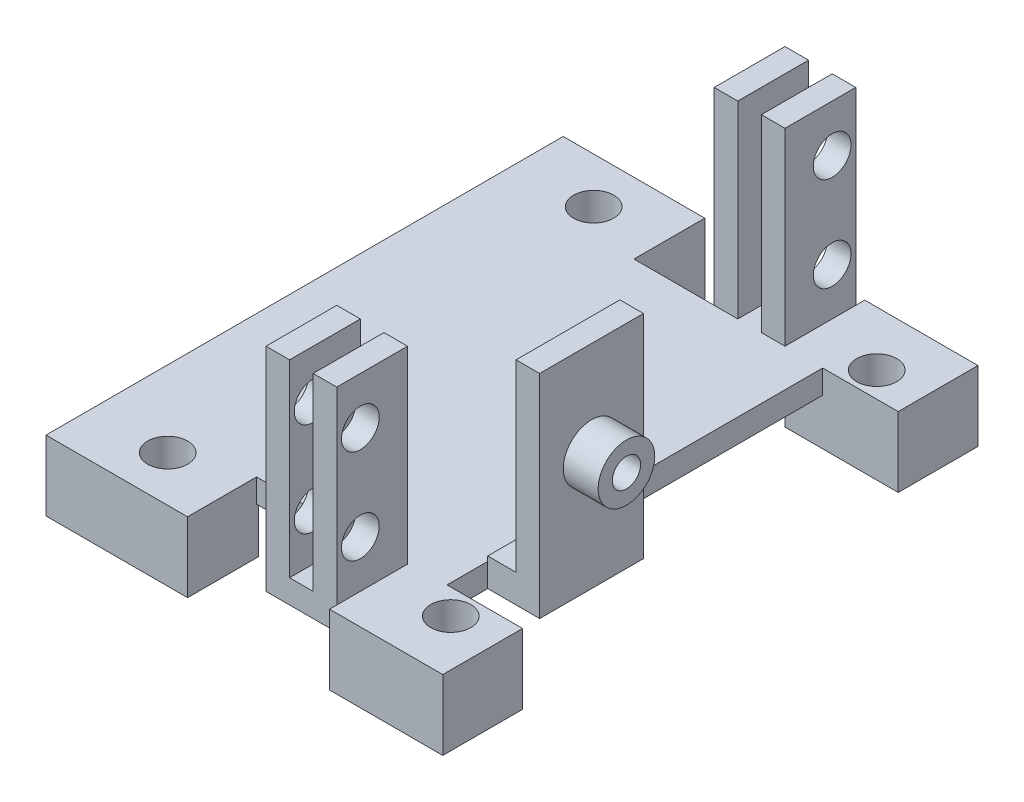
from build123d import *

# Parameters (mm, degrees)
SKETCH_1_W                = 211.717851242
SKETCH_1_H                = 121.662509304
EXTRUDE_1_DEPTH           = 10
SKETCH_2_W                = 5
SKETCH_2_H                = 15
EXTRUDE_2_DEPTH           = 40
CUT_EXTRUDE_1_DEPTH       = 129.477833404
CUT_EXTRUDE_1_DEPTH_BACK  = 129.477833404
SKETCH_3_OUTSIDE_W        = 263.568
SKETCH_3_OUTSIDE_H        = 173.512
SKETCH_4_W                = 15
SKETCH_4_H                = 15
EXTRUDE_3_DEPTH           = 10
CUT_EXTRUDE_2_DEPTH       = 130.428976448
CUT_EXTRUDE_2_DEPTH_BACK  = 5
SKETCH_5_W                = 251.048169007
SKETCH_5_H                = 208.83861988
CUT_EXTRUDE_3_DEPTH       = 97.900711095
CUT_EXTRUDE_3_DEPTH_BACK  = 97.900711095
SKETCH_7_R                = 4
SKETCH_8_W                = 6
SKETCH_8_H                = 22
EXTRUDE_6_DEPTH           = 6
CUT_EXTRUDE_4_DEPTH       = 128.58079771
CUT_EXTRUDE_4_DEPTH_BACK  = 128.58079771
SKETCH_10_W               = 17
SKETCH_10_H               = 6
EXTRUDE_7_DEPTH           = 5
SKETCH_11_R               = 11
EXTRUDE_8_DEPTH           = 0.6
SKETCH_12_R               = 6
EXTRUDE_9_DEPTH           = 7.4
CUT_EXTRUDE_10_DEPTH      = 116.586797735
CUT_EXTRUDE_10_DEPTH_BACK = 3
SKETCH_13_R               = 3
EXTRUDE_10_DEPTH          = 45
SKETCH_15_R               = 9.319080667
CUT_EXTRUDE_11_DEPTH      = 38
SKETCH_16_R               = 6
EXTRUDE_11_DEPTH          = 7.4
SKETCH_17_R               = 3
CUT_EXTRUDE_12_DEPTH      = 5
SKETCH_18_W               = 30
SKETCH_18_H               = 15
EXTRUDE_12_DEPTH          = 14.850514471
EXTRUDE_13_DEPTH          = 14.850514471
SKETCH_22_W               = 24
SKETCH_22_H               = 16.908951495
EXTRUDE_14_DEPTH          = 14.850514471
SKETCH_23_R               = 4.25
CUT_EXTRUDE_15_DEPTH      = 60
EXTRUDE_15_DEPTH          = 14.850514471
SKETCH_25_R               = 4.25
CUT_EXTRUDE_16_DEPTH      = 60
SKETCH_19_R               = 4.25
CUT_EXTRUDE_17_DEPTH      = 60
SKETCH_26_W               = 38.044769018
SKETCH_26_H               = 21.34609726
SKETCH_26_W_2             = 24.699869201
SKETCH_26_H_2             = 16.908951494
CUT_EXTRUDE_18_DEPTH      = 60
SKETCH_27_W               = 6.321147669
SKETCH_27_H               = 14.747228213
CUT_EXTRUDE_19_DEPTH      = 39


with BuildPart() as part:
    # 草图1 → 凸台-拉伸1 (new body)
    with BuildSketch(Plane(origin=(0, 0, 0), x_dir=(1, 0, 0), z_dir=(0, 1, 0))):
        Rectangle(SKETCH_1_W, SKETCH_1_H)
    extrude(amount=EXTRUDE_1_DEPTH)

    # 草图2 → 凸台-拉伸2 (add)
    with BuildSketch(Plane(origin=(0, 10, 0), x_dir=(1, 0, 0), z_dir=(0, 1, 0))):
        with Locations((-46.358925621, 47.311705854)):
            Rectangle(SKETCH_2_W, SKETCH_2_H)
        with Locations((-56.358925621, 47.311705854)):
            Rectangle(SKETCH_2_W, SKETCH_2_H)
        with Locations((-46.358925621, -47.688294146)):
            Rectangle(SKETCH_2_W, SKETCH_2_H)
        with Locations((-56.358925621, -47.688294146)):
            Rectangle(SKETCH_2_W, SKETCH_2_H)
    extrude(amount=EXTRUDE_2_DEPTH)

    # 草图3 outside → 切除-拉伸1 (cut, two sides: drawn at the far end of the back side and taken through both)
    with BuildSketch(Plane(origin=(0, 10, 0), x_dir=(1, 0, 0), z_dir=(0, 1, 0)).offset(-CUT_EXTRUDE_1_DEPTH_BACK)):
        Rectangle(SKETCH_3_OUTSIDE_W, SKETCH_3_OUTSIDE_H)
        Polygon((-105.858925621, 39.811705854), (-58.858925621, 39.811705854), (-58.858925621, 54.811705854), (-43.858925621, 54.811705854), (-43.858925621, 39.811705854), (-35.858925621, 39.811705854), (-35.858925621, -40.188294146), (-43.858925621, -40.188294146), (-43.858925621, -55.188294146), (-48.858925621, -55.188294146), (-48.858925621, -40.188294146), (-53.858925621, -40.188294146), (-53.858925621, -55.188294146), (-58.858925621, -55.188294146), (-58.858925621, -40.188294146), (-106.714815402, -40.188294146), align=None, mode=Mode.SUBTRACT)
    extrude(amount=CUT_EXTRUDE_1_DEPTH + CUT_EXTRUDE_1_DEPTH_BACK, mode=Mode.SUBTRACT)

    # 草图4 → 凸台-拉伸3 (add)
    with BuildSketch(Plane.XZ):
        with Locations((-51.358925621, 47.688294146)):
            Rectangle(SKETCH_4_W, SKETCH_4_H)
    extrude(amount=-EXTRUDE_3_DEPTH)

    # 草图5 → 切除-拉伸2 (cut, two sides: drawn at the far end of the back side and taken through both)
    with BuildSketch(Plane.XZ.offset(-CUT_EXTRUDE_2_DEPTH_BACK)):
        with Locations((-99.962010128, 39.987109066)):
            Rectangle(SKETCH_5_W, SKETCH_5_H)
    extrude(amount=CUT_EXTRUDE_2_DEPTH + CUT_EXTRUDE_2_DEPTH_BACK, mode=Mode.SUBTRACT)

    # 草图7 → 切除-拉伸3 (cut, two sides: drawn at the far end of the back side and taken through both)
    with BuildSketch(Plane(origin=(-43.858925621, 0, 0), x_dir=(0, 0, -1), z_dir=(1, 0, 0)).offset(-CUT_EXTRUDE_3_DEPTH_BACK)):
        with Locations((-50.188294146, 40)):
            Circle(SKETCH_7_R)
        with Locations((-50.188294146, 20)):
            Circle(SKETCH_7_R)
        with Locations((49.811705854, 40)):
            Circle(SKETCH_7_R)
        with Locations((49.811705854, 20)):
            Circle(SKETCH_7_R)
    extrude(amount=CUT_EXTRUDE_3_DEPTH + CUT_EXTRUDE_3_DEPTH_BACK, mode=Mode.SUBTRACT)

    # 草图8 → 凸台-拉伸6 (add)
    with BuildSketch(Plane.XZ.offset(-5)):
        with Locations((-32.858925621, 20.188294146)):
            Rectangle(SKETCH_8_W, SKETCH_8_H)
    extrude(amount=-EXTRUDE_6_DEPTH)

    # 草图9 → 切除-拉伸4 (cut, two sides: drawn at the far end of the back side and taken through both)
    with BuildSketch(Plane.XZ.offset(-5).offset(-CUT_EXTRUDE_4_DEPTH_BACK)):
        Polygon((-34.858925621, 39.188294146), (-34.858925621, 31.188294146), (-29.207793941, 25.537162465), (-29.207793941, 39.188294146), align=None)
    extrude(amount=CUT_EXTRUDE_4_DEPTH + CUT_EXTRUDE_4_DEPTH_BACK, mode=Mode.SUBTRACT)

    # 草图10 → 凸台-拉伸7 (add)
    with BuildSketch(Plane(origin=(-29.858925621, 0, 0), x_dir=(0, 0, -1), z_dir=(1, 0, 0))):
        Polygon((-31.188294146, 5), (-26.188294146, 5), (-26.188294146, 11), (-9.188294146, 11), (-9.188294146, 50), (-31.188294146, 50), align=None)
        with Locations((-17.688294146, 8)):
            Rectangle(SKETCH_10_W, SKETCH_10_H)
    extrude(amount=EXTRUDE_7_DEPTH)

    # 草图11 → 凸台-拉伸8 (add)
    with BuildSketch(Plane(origin=(-24.858925621, 0, 0), x_dir=(0, 0, -1), z_dir=(1, 0, 0))):
        with Locations((-20.188294146, 27.5)):
            Circle(SKETCH_11_R)
    extrude(amount=-EXTRUDE_8_DEPTH)

    # 草图12 → 凸台-拉伸9 (add)
    with BuildSketch(Plane(origin=(-24.858925621, 0, 0), x_dir=(0, 0, -1), z_dir=(1, 0, 0))):
        with Locations((-20.188294146, 27.5)):
            Circle(SKETCH_12_R)
    extrude(amount=EXTRUDE_9_DEPTH)

    # 草图13 → 切除-拉伸10 (cut, two sides: drawn at the far end of the back side and taken through both)
    with BuildSketch(Plane(origin=(-17.458925621, 0, 0), x_dir=(0, 0, -1), z_dir=(1, 0, 0)).offset(-CUT_EXTRUDE_10_DEPTH_BACK)):
        with Locations(Location((-20.188294146, 27.5, 0), (0, 0, 180))):
            Circle(SKETCH_13_R)
    extrude(amount=CUT_EXTRUDE_10_DEPTH + CUT_EXTRUDE_10_DEPTH_BACK, mode=Mode.SUBTRACT)

    # 草图14 → 凸台-拉伸10 (add)
    with BuildSketch(Plane(origin=(0, 5, 0), x_dir=(-1, 0, 0), z_dir=(0, -1, 0))):
        Polygon((34.858925621, -31.188294146), (29.858925621, -31.188294146), (29.858925621, -26.188294146), align=None)
    extrude(amount=-EXTRUDE_10_DEPTH)

    # 草图15 → 切除-拉伸11 (cut)
    with BuildSketch(Plane(origin=(-24.858925621, 0, 0), x_dir=(0, 0, -1), z_dir=(1, 0, 0))):
        with Locations((-20.188294146, 27.5)):
            Circle(SKETCH_15_R)
    extrude(amount=CUT_EXTRUDE_11_DEPTH, mode=Mode.SUBTRACT)

    # 草图16 → 凸台-拉伸11 (add)
    with BuildSketch(Plane(origin=(-24.858925621, 0, 0), x_dir=(0, 0, -1), z_dir=(1, 0, 0))):
        with Locations((-20.188294146, 30)):
            Circle(SKETCH_16_R)
    extrude(amount=EXTRUDE_11_DEPTH)

    # 草图17 → 切除-拉伸12 (cut)
    with BuildSketch(Plane(origin=(-17.458925621, 0, 0), x_dir=(0, 0, -1), z_dir=(1, 0, 0))):
        with Locations((-20.188294146, 30)):
            Circle(SKETCH_17_R)
    extrude(amount=-CUT_EXTRUDE_12_DEPTH, mode=Mode.SUBTRACT)

    # 草图18 → 凸台-拉伸12 (add)
    with BuildSketch(Plane(origin=(0, 10, 0), x_dir=(1, 0, 0), z_dir=(0, 1, 0))):
        with Locations((-90.858925621, 47.311705854)):
            Rectangle(SKETCH_18_W, SKETCH_18_H)
    extrude_12 = extrude(amount=-EXTRUDE_12_DEPTH)

    # 草图22 → 凸台-拉伸14 (add)
    with BuildSketch(Plane(origin=(0, 10, 0), x_dir=(1, 0, 0), z_dir=(0, 1, 0))):
        with Locations((-31.858925621, 48.266181602)):
            Rectangle(SKETCH_22_W, SKETCH_22_H)
    extrude_14 = extrude(amount=-EXTRUDE_14_DEPTH)

    # 草图23 → 切除-拉伸15 (cut)
    with BuildSketch(Plane(origin=(0, 10, 0), x_dir=(1, 0, 0), z_dir=(0, 1, 0))):
        with Locations(Location((-29.74274895, 45.141181602, 0), (0, 0, 270))):
            Circle(SKETCH_23_R)
    cut_extrude_15 = extrude(amount=-CUT_EXTRUDE_15_DEPTH, mode=Mode.SUBTRACT)

    # 草图24 → 凸台-拉伸15 (add)
    with BuildSketch(Plane(origin=(0, -4.850514471, 0), x_dir=(1, 0, 0), z_dir=(0, 1, 0))):
        Polygon((-43.858925621, -40.188294146), (-43.858925621, -57.09724564), (-19.74274895, -40.233286806), (-19.74274895, -40.188294146), align=None)
    extrude(amount=EXTRUDE_15_DEPTH)

    # 草图25 → 切除-拉伸16 (cut)
    with BuildSketch(Plane(origin=(0, 10, 0), x_dir=(1, 0, 0), z_dir=(0, 1, 0))):
        with Locations((-29.74274895, -45.517769893)):
            Circle(SKETCH_25_R)
    extrude(amount=-CUT_EXTRUDE_16_DEPTH, mode=Mode.SUBTRACT)

    # 草图19 → 切除-拉伸17 (cut)
    with BuildSketch(Plane(origin=(0, 10, 0), x_dir=(1, 0, 0), z_dir=(0, 1, 0))):
        with Locations(Location((-89.74274895, 45.141181602, 0), (0, 0, 270))):
            Circle(SKETCH_19_R)
    cut_extrude_17 = extrude(amount=-CUT_EXTRUDE_17_DEPTH, mode=Mode.SUBTRACT)


with BuildPart() as body_2:
    # 草图20 → 凸台-拉伸13 (new body)
    with BuildSketch(Plane(origin=(0, 10, 0), x_dir=(1, 0, 0), z_dir=(0, 1, 0))):
        Polygon((-105.858925621, -40.188294146), (-74.74274895, -56.834668943), (-74.74274895, -57.09724564), (-105.858925621, -57.09724564), align=None)
    extrude(amount=-EXTRUDE_13_DEPTH)


with BuildPart() as cut_extrude_18_tool:
    # 草图26 → 切除-拉伸18 (new body)
    with BuildSketch(Plane(origin=(0, 10, 0), x_dir=(1, 0, 0), z_dir=(0, 1, 0))):
        with Locations((-86.836541112, -50.861342776)):
            Rectangle(SKETCH_26_W, SKETCH_26_H)
        with Locations((-31.508991021, -48.642769893)):
            Rectangle(SKETCH_26_W_2, SKETCH_26_H_2)
    extrude(amount=-CUT_EXTRUDE_18_DEPTH)


with BuildPart() as part_1:
    add(part.part)

    # 切除-拉伸18: cut by cut_extrude_18_tool
    add(cut_extrude_18_tool.part, mode=Mode.SUBTRACT)

    # 镜向1: 凸台-拉伸12, 凸台-拉伸14, 切除-拉伸15, 切除-拉伸17 across plane
    add(extrude_12.mirror(Plane.XY))
    add(extrude_14.mirror(Plane.XY))
    add(cut_extrude_15.mirror(Plane.XY), mode=Mode.SUBTRACT)
    add(cut_extrude_17.mirror(Plane.XY), mode=Mode.SUBTRACT)

    # 草图27 → 切除-拉伸19 (cut)
    with BuildSketch(Plane(origin=(0, 50, 0), x_dir=(1, 0, 0), z_dir=(0, 1, 0))):
        with Locations((-33.019499456, -25.654978199)):
            Rectangle(SKETCH_27_W, SKETCH_27_H)
    extrude(amount=-CUT_EXTRUDE_19_DEPTH, mode=Mode.SUBTRACT)


with BuildPart() as body_2_1:
    add(body_2.part)

    # 切除-拉伸18: cut by cut_extrude_18_tool
    add(cut_extrude_18_tool.part, mode=Mode.SUBTRACT)


solid = part_1.part
